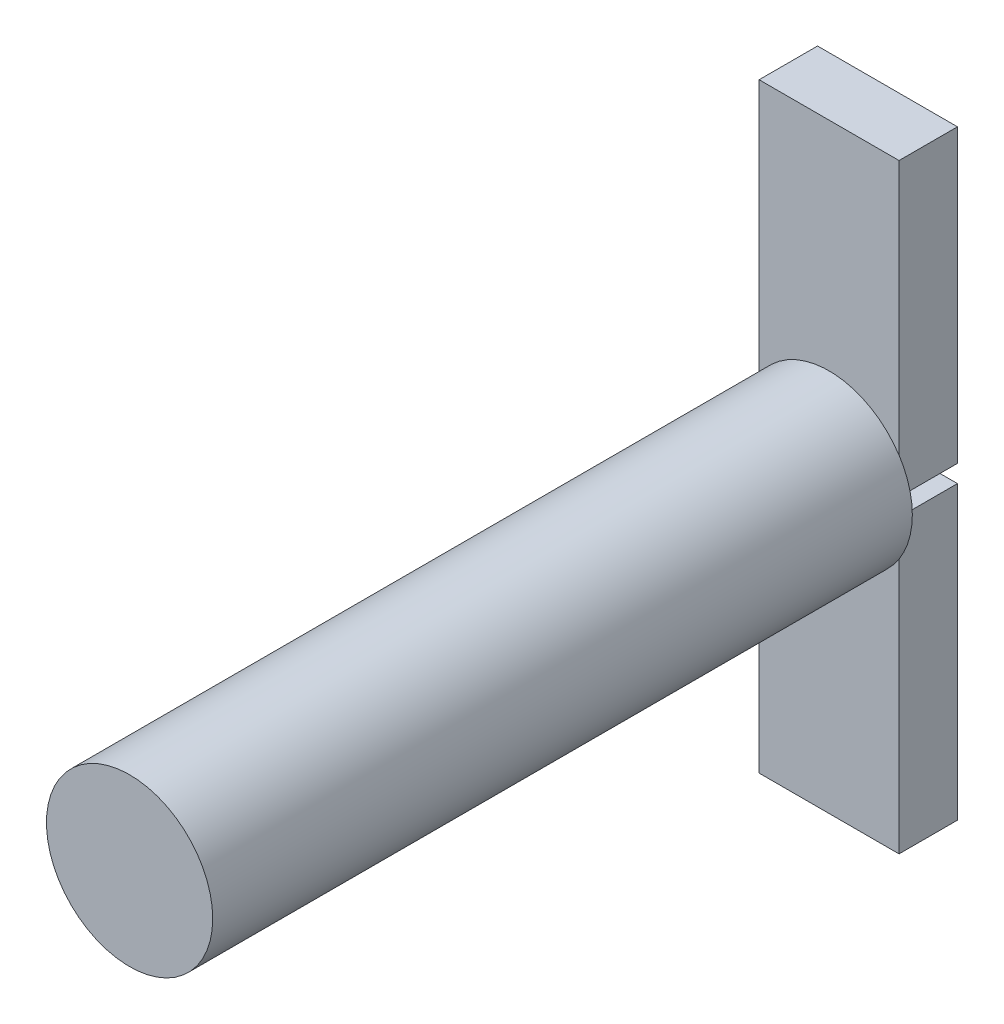
from build123d import *

# Parameters (mm, degrees)
SKETCH1_R                = 7.13
BOSS_EXTRUDE1_DEPTH      = 60
BOSS_EXTRUDE2_DEPTH      = 0.01
BOSS_EXTRUDE2_DEPTH_BACK = 5
SKETCH2_W                = 12
SKETCH2_H                = 25


with BuildPart() as part:
    # Sketch1 → Boss-Extrude1 (new body)
    with BuildSketch(Plane.XY):
        Circle(SKETCH1_R)
    extrude(amount=BOSS_EXTRUDE1_DEPTH)

    # Sketch2 → Boss-Extrude2 (add, two sides: drawn at the far end of the back side and taken through both)
    with BuildSketch(Plane.XY.offset(-BOSS_EXTRUDE2_DEPTH_BACK)):
        with Locations((0, -13.25)):
            Rectangle(SKETCH2_W, SKETCH2_H)
        with Locations((0, 13.25)):
            Rectangle(SKETCH2_W, SKETCH2_H)
    extrude(amount=BOSS_EXTRUDE2_DEPTH + BOSS_EXTRUDE2_DEPTH_BACK)


solid = part.part
